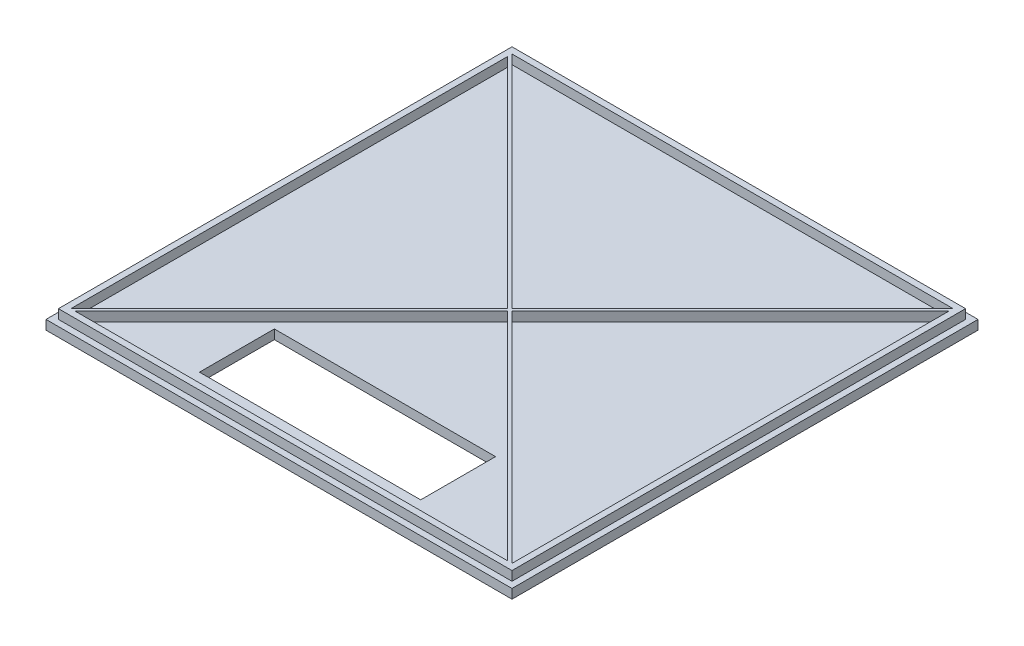
from build123d import *

# Parameters (mm, degrees)
SKETCH1_W           = 150
SKETCH1_H           = 150
BOSS_EXTRUDE1_DEPTH = 3
SKETCH2_W           = 146
SKETCH2_H           = 146
BOSS_EXTRUDE2_DEPTH = 3
SKETCH3_W           = 142
SKETCH3_H           = 142
CUT_EXTRUDE1_DEPTH  = 3
EXTRUDE_THIN1_DEPTH = 3
CUT_EXTRUDE5_START  = -3
SKETCH5_W           = 71.2
SKETCH5_H           = 24.1
CUT_EXTRUDE5_DEPTH  = 3


with BuildPart() as part:
    # Sketch1 → Boss-Extrude1 (new body)
    with BuildSketch(Plane(origin=(0, 0, 0), x_dir=(1, 0, 0), z_dir=(0, 1, 0))):
        Rectangle(SKETCH1_W, SKETCH1_H)
    extrude(amount=-BOSS_EXTRUDE1_DEPTH)

    # Sketch2 → Boss-Extrude2 (add)
    with BuildSketch(Plane(origin=(0, 0, 0), x_dir=(1, 0, 0), z_dir=(0, 1, 0))):
        Rectangle(SKETCH2_W, SKETCH2_H)
    extrude(amount=BOSS_EXTRUDE2_DEPTH)

    # Sketch3 → Cut-Extrude1 (cut)
    with BuildSketch(Plane(origin=(0, 0, 0), x_dir=(1, 0, 0), z_dir=(0, 1, 0))):
        Rectangle(SKETCH3_W, SKETCH3_H)
    extrude(amount=CUT_EXTRUDE1_DEPTH, mode=Mode.SUBTRACT)

    # Sketch4 → Extrude-Thin1 (add)
    with BuildSketch(Plane(origin=(0, 0, 0), x_dir=(1, 0, 0), z_dir=(0, 1, 0))):
        Polygon((-71, 71), (71, -71), (70.292893219, -71.707106781), (-71.707106781, 70.292893219), align=None)
        Polygon((-71, -71), (71, 71), (71.707106781, 70.292893219), (-70.292893219, -71.707106781), align=None)
    extrude(amount=EXTRUDE_THIN1_DEPTH)

    # Sketch5 → Cut-Extrude5 (cut)
    with BuildSketch(Plane(origin=(0, 0, 0), x_dir=(1, 0, 0), z_dir=(0, 1, 0)).offset(CUT_EXTRUDE5_START)):
        with Locations((0, -52.95)):
            Rectangle(SKETCH5_W, SKETCH5_H)
    extrude(amount=CUT_EXTRUDE5_DEPTH, mode=Mode.SUBTRACT)


solid = part.part
